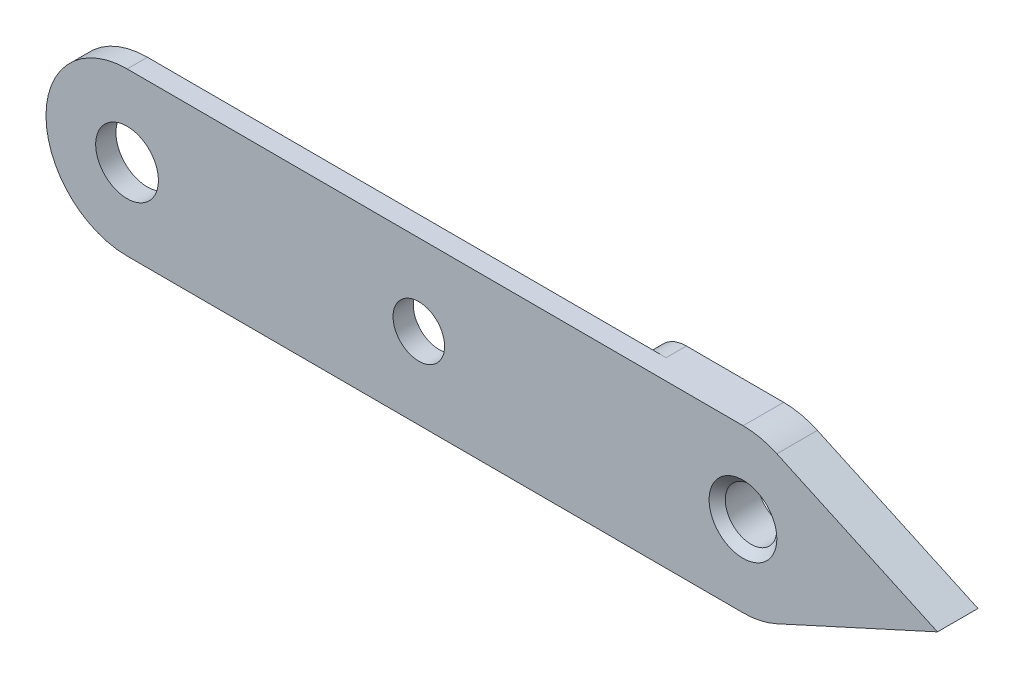
from build123d import *

# Parameters (mm, degrees)
SKETCH2_R                        = 0.635
SKETCH2_R_2                      = 1.5875
BOSS_EXTRUDE1_DEPTH              = 1.5875
F_10_0_1935_DIAMETER_HOLE1_D     = 4.9149
BOSS_EXTRUDE2_START              = 1.5875
BOSS_EXTRUDE2_DEPTH              = 1.5875
F_10_32_TAPPED_HOLE1_D           = 4.0386
F_10_32_TAPPED_HOLE1_DEPTH       = 9.398
F_10_32_TAPPED_HOLE1_CSINK_D     = 5.3086
F_10_32_TAPPED_HOLE1_CSINK_ANGLE = 90
F_10_32_TAPPED_HOLE1_TIP         = 1.213317848
BOSS_EXTRUDE3_START              = -3.175
BOSS_EXTRUDE3_DEPTH              = 3.175
F_10_32_TAPPED_HOLE2_D           = 4.0386


with BuildPart() as part:
    # Sketch2 → Boss-Extrude1 (new body)
    with BuildSketch(Plane.XY.offset(-44.699989247)):
        with BuildLine():
            Line((-22.87049754, -6.312086997), (25.389436119, -6.392107131))
            ThreePointArc((25.389436119, -6.392107131), (31.749956355, -0.052644824), (25.410494049, 6.307875411))
            Line((25.410494049, 6.307875411), (-22.84943961, 6.387895545))
            ThreePointArc((-22.84943961, 6.387895545), (-29.209959846, 0.048433239), (-22.87049754, -6.312086997))
        make_face()
        with Locations((25.399965084, -0.04211586)):
            Circle(SKETCH2_R, mode=Mode.SUBTRACT)
        Circle(SKETCH2_R_2, mode=Mode.SUBTRACT)
        with Locations((-22.859968575, 0.037904274)):
            Circle(SKETCH2_R, mode=Mode.SUBTRACT)
    extrude(amount=BOSS_EXTRUDE1_DEPTH)

    # #10 (0.1935) Diameter Hole1 (through all)
    with Locations(Plane.XY.offset(-43.112489247)):
        with Locations((-22.859968575, 0.037904274)):
            Hole(F_10_0_1935_DIAMETER_HOLE1_D / 2)

    # Sketch5 → Boss-Extrude2 (add)
    with BuildSketch(Plane(origin=(0, 0, -44.699989247), x_dir=(-1, 0, 0), z_dir=(0, 0, -1)).offset(BOSS_EXTRUDE2_START)):
        with BuildLine():
            Line((-25.389436119, -6.392107131), (-17.769446594, -6.379472373))
            ThreePointArc((-17.769446594, -6.379472373), (-15.974631383, -5.632546579), (-15.233661671, -3.835264278))
            Line((-15.233661671, -3.835264278), (-15.246296429, 3.784725247))
            ThreePointArc((-15.246296429, 3.784725247), (-15.993222223, 5.579540457), (-17.790504524, 6.320510169))
            Line((-17.790504524, 6.320510169), (-25.410494049, 6.307875411))
            ThreePointArc((-25.410494049, 6.307875411), (-31.749956355, -0.052644824), (-25.389436119, -6.392107131))
        make_face()
    extrude(amount=-BOSS_EXTRUDE2_DEPTH)

    # #10-32 Tapped Hole1
    with Locations(Plane.XY.offset(-43.112489247)):
        with Locations((25.399965084, -0.04211586)):
            CounterSinkHole(F_10_32_TAPPED_HOLE1_D / 2, F_10_32_TAPPED_HOLE1_CSINK_D / 2, depth=F_10_32_TAPPED_HOLE1_DEPTH, counter_sink_angle=F_10_32_TAPPED_HOLE1_CSINK_ANGLE)
            with Locations((0, 0, -(F_10_32_TAPPED_HOLE1_DEPTH + F_10_32_TAPPED_HOLE1_TIP / 2))):  # 118° drill point
                Cone(0, F_10_32_TAPPED_HOLE1_D / 2, F_10_32_TAPPED_HOLE1_TIP, mode=Mode.SUBTRACT)

    # Sketch8 → Boss-Extrude3 (add)
    with BuildSketch(Plane.XY.offset(-43.112489247).offset(BOSS_EXTRUDE3_START)):
        with BuildLine():
            Line((28.055366234, 5.726015964), (40.639944134, -0.067385375))
            Line((40.639944134, -0.067385375), (28.036223326, -5.81902182))
            ThreePointArc((28.036223326, -5.81902182), (31.749956355, -0.052644824), (28.055366234, 5.726015964))
        make_face()
    extrude(amount=BOSS_EXTRUDE3_DEPTH)

    # #10-32 Tapped Hole2 (through all)
    with Locations(Plane.XY.offset(-43.112489247)):
        with Locations((0, 0)):
            Hole(F_10_32_TAPPED_HOLE2_D / 2)


solid = part.part
